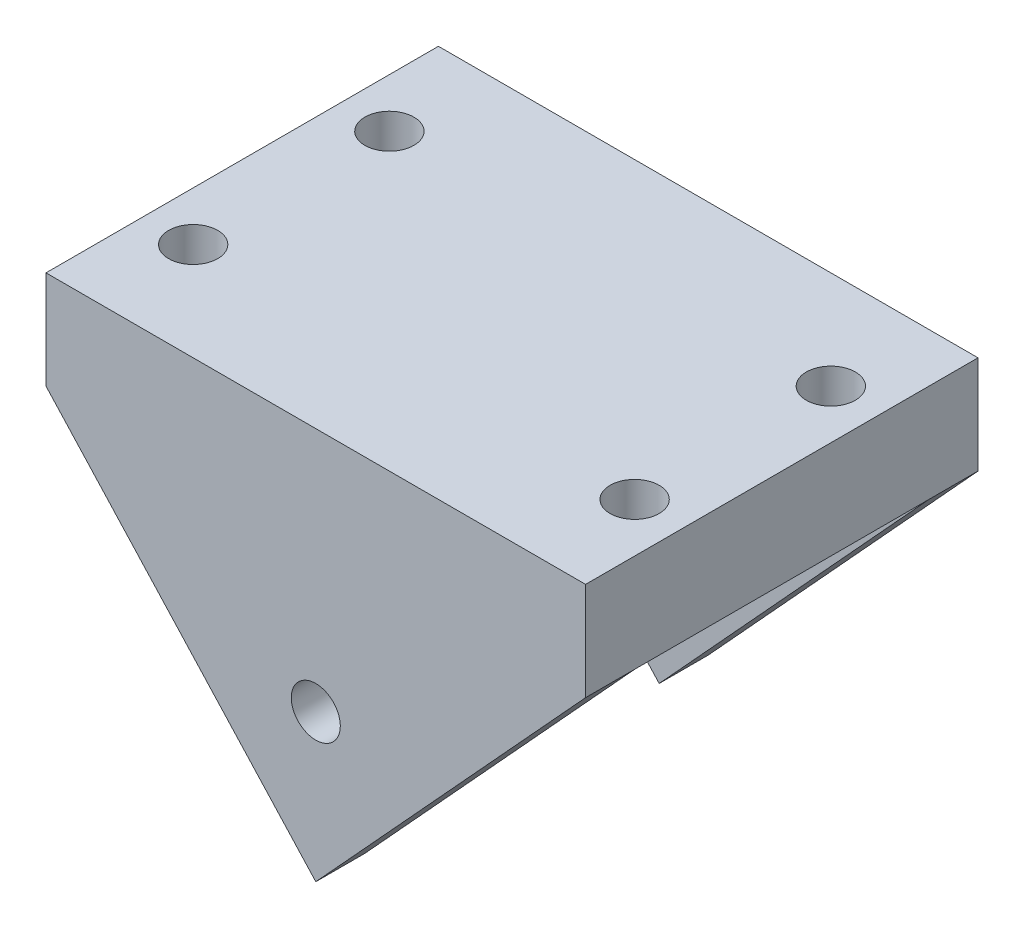
from build123d import *

# Parameters (mm, degrees)
SKETCH1_W           = 110
SKETCH1_H           = 60
BOSS_EXTRUDE1_DEPTH = 20
SKETCH3_R           = 5
CUT_EXTRUDE1_DEPTH  = 10
BOSS_EXTRUDE2_DEPTH = 10
SKETCH5_R           = 5
CUT_EXTRUDE2_DEPTH  = 115.127122105


with BuildPart() as part:
    # Sketch1 → Boss-Extrude1 (new body)
    with BuildSketch(Plane(origin=(0, 0, 0), x_dir=(1, 0, 0), z_dir=(0, 1, 0))):
        Rectangle(SKETCH1_W, SKETCH1_H)
    extrude(amount=BOSS_EXTRUDE1_DEPTH)

    # Sketch3 → Cut-Extrude1 (cut)
    with BuildSketch(Plane(origin=(0, 20, 0), x_dir=(1, 0, 0), z_dir=(0, 1, 0))):
        with Locations(Location((-45, 20, 0), (0, 0, 270))):
            Circle(SKETCH3_R)
        with Locations(Location((45, 20, 0), (0, 0, 270))):
            Circle(SKETCH3_R)
        with Locations(Location((45, -20, 0), (0, 0, 270))):
            Circle(SKETCH3_R)
        with Locations(Location((-45, -20, 0), (0, 0, 270))):
            Circle(SKETCH3_R)
    extrude(amount=-CUT_EXTRUDE1_DEPTH, mode=Mode.SUBTRACT)

    # Sketch4 → Boss-Extrude2 (add)
    with BuildSketch(Plane.XY.offset(30)):
        Polygon((-55, 0), (0, -60), (55, 0), (55, 20), (-55, 20), align=None)
    boss_extrude2 = extrude(amount=BOSS_EXTRUDE2_DEPTH)

    # Mirror1: Boss-Extrude2 across plane
    add(boss_extrude2.mirror(Plane.XY))

    # Sketch5 → Cut-Extrude2 (cut, through all)
    with BuildSketch(Plane.XY.offset(40)):
        with Locations((0, -30)):
            Circle(SKETCH5_R)
    extrude(amount=-CUT_EXTRUDE2_DEPTH, mode=Mode.SUBTRACT)


solid = part.part
